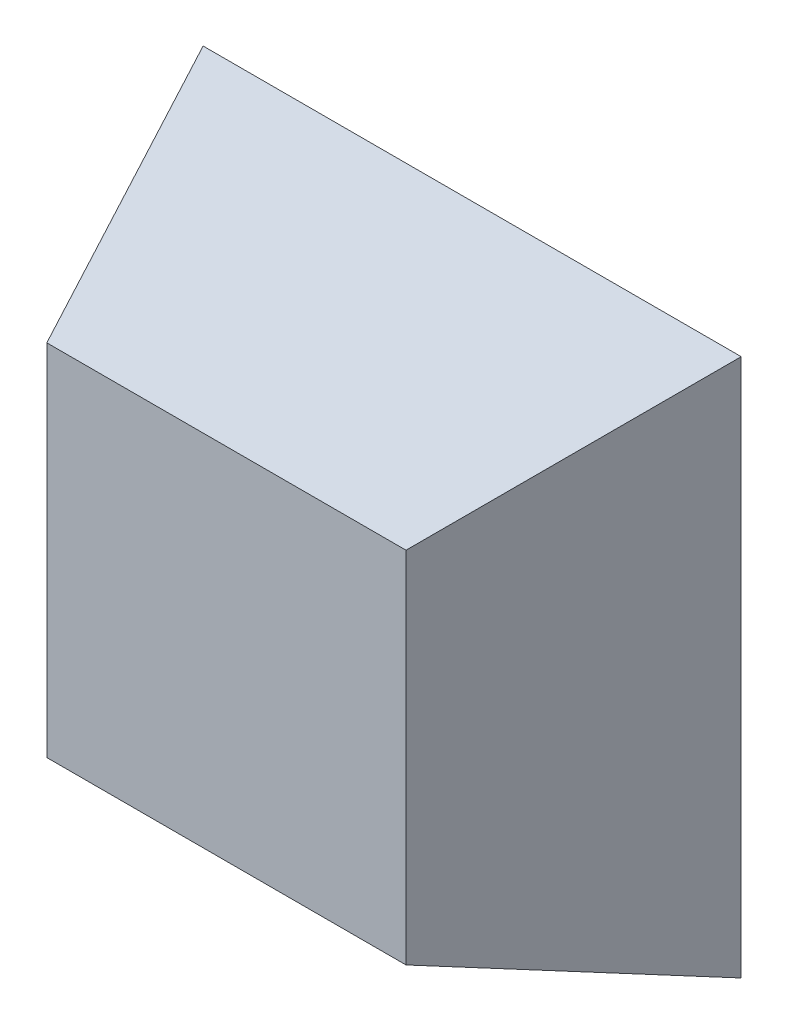
from build123d import *

# Parameters (mm, degrees)
ESQUISSE1_W          = 12.7
ESQUISSE1_H          = 12.7
BASE_EXTRUSION_DEPTH = 5.8
BASE_EXTRUSION_TAPER = 20


with BuildPart() as part:
    # Esquisse1 → Base-Extrusion (new body)
    with BuildSketch(Plane.XY):
        with Locations((85.5, -98.5)):
            Rectangle(ESQUISSE1_W, ESQUISSE1_H)
    extrude(amount=BASE_EXTRUSION_DEPTH, taper=BASE_EXTRUSION_TAPER)


solid = part.part
